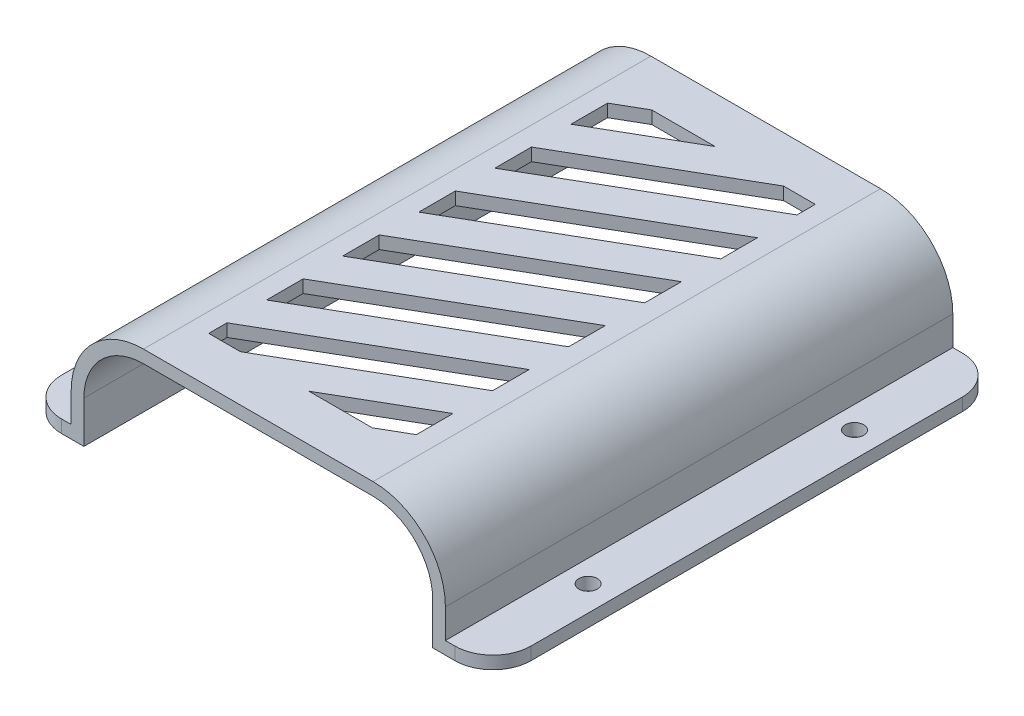
from build123d import *

# Parameters (mm, degrees)
EXTRUDE_1_DEPTH     = 80
SKETCH_2_R          = 1.45
CUT_EXTRUDE_1_DEPTH = 80
FILLET_1_R          = 6
CUT_EXTRUDE_2_DEPTH = 10


with BuildPart() as part:
    # 草图1 → 凸台-拉伸1 (new body)
    with BuildSketch(Plane.XY):
        with BuildLine():
            Line((-37, 0), (-27.5, 0))
            Line((-27.5, 0), (-27.5, 6.6))
            ThreePointArc((-27.5, 6.6), (-24.746803743, 13.246803743), (-18.1, 16))
            Line((-18.1, 16), (18.1, 16))
            ThreePointArc((18.1, 16), (24.746803743, 13.246803743), (27.5, 6.6))
            Line((27.5, 6.6), (27.5, 0))
            Line((27.5, 0), (37, 0))
            Line((37, 0), (37, 2))
            Line((37, 2), (29.5, 2))
            Line((29.5, 2), (29.5, 6.6))
            ThreePointArc((29.5, 6.6), (26.161017306, 14.661017306), (18.1, 18))
            Line((18.1, 18), (-18.1, 18))
            ThreePointArc((-18.1, 18), (-26.161017306, 14.661017306), (-29.5, 6.6))
            Line((-29.5, 6.6), (-29.5, 2))
            Line((-29.5, 2), (-37, 2))
            Line((-37, 2), (-37, 0))
        make_face()
    extrude(amount=EXTRUDE_1_DEPTH)

    # 草图2 → 切除-拉伸1 (cut)
    with BuildSketch(Plane(origin=(0, 2, 0), x_dir=(1, 0, 0), z_dir=(0, 1, 0))):
        with Locations(Location((-33, -19, 0), (0, 0, 180))):
            Circle(SKETCH_2_R)
        with Locations(Location((-33, -61, 0), (0, 0, 270))):
            Circle(SKETCH_2_R)
        with Locations(Location((33, -61, 0), (0, 0, 180))):
            Circle(SKETCH_2_R)
        with Locations(Location((33, -19, 0), (0, 0, 180))):
            Circle(SKETCH_2_R)
    extrude(amount=-CUT_EXTRUDE_1_DEPTH, mode=Mode.SUBTRACT)

    # 圆角1
    fillet_1_edges = [part.edges().sort_by_distance(p)[0] for p in [
        (37, 1, 0),
        (-37, 1, 0),
        (37, 1, 80),
        (-37, 1, 80),
    ]]
    fillet(fillet_1_edges, radius=FILLET_1_R)

    # 草图3 → 切除-拉伸2 (cut)
    with BuildSketch(Plane(origin=(0, 18, 0), x_dir=(1, 0, 0), z_dir=(0, 1, 0))):
        Polygon((0.684609691, -72.718226784), (10.684609691, -72.718226784), (15.1, -70.169), (15.1, -64.395497308), align=None)
        Polygon((-15.1, -72.718226784), (-10.1, -72.718226784), (15.1, -58.169), (15.1, -52.395497308), (-15.1, -69.831475438), align=None)
        Polygon((-15.1, -57.831475438), (-15.1, -63.60497813), (15.1, -46.169), (15.1, -40.395497308), align=None)
        Polygon((-15.1, -45.831475438), (-15.1, -51.60497813), (15.1, -34.169), (15.1, -28.395497308), align=None)
        Polygon((-15.1, -33.831475438), (-15.1, -39.60497813), (15.1, -22.169), (15.1, -16.395497308), align=None)
        Polygon((10.1, -7.282248654), (15.1, -7.282248654), (15.1, -10.169), (-15.1, -27.60497813), (-15.1, -21.831475438), align=None)
        Polygon((-15.1, -9.831475438), (-15.1, -15.60497813), (-0.684609691, -7.282248654), (-10.684609691, -7.282248654), align=None)
    extrude(amount=-CUT_EXTRUDE_2_DEPTH, mode=Mode.SUBTRACT)


solid = part.part
